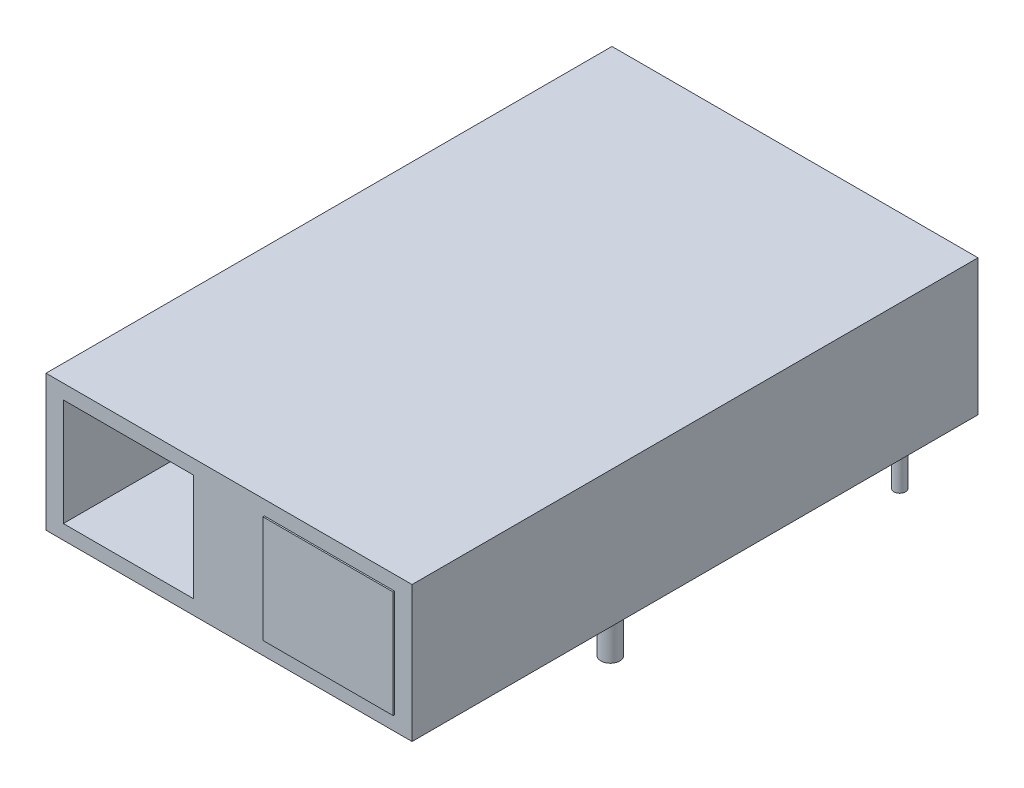
from build123d import *

# Parameters (mm, degrees)
EXTRUDE_1_DEPTH      = 4.7
EXTRUDE_1_DEPTH_BACK = 4.7
SKETCH_1_W           = 25.3
SKETCH_1_H           = 39.12
SKETCH_2_W           = 9
SKETCH_2_H           = 7.4
CUT_EXTRUDE_2_DEPTH  = 10
SKETCH_3_W           = 9
SKETCH_3_H           = 7.4
EXTRUDE_4_DEPTH      = 0.1
SKETCH_4_R           = 0.65
SKETCH_4_R_2         = 0.4
EXTRUDE_3_DEPTH      = 4.2


with BuildPart() as part:
    # 草图1 → 凸台-拉伸1 (new, two sides: drawn at the far end of the back side and taken through both)
    with BuildSketch(Plane(origin=(0, 0, 0), x_dir=(1, 0, 0), z_dir=(0, 1, 0)).offset(-EXTRUDE_1_DEPTH_BACK)):
        Rectangle(SKETCH_1_W, SKETCH_1_H)
    extrude(amount=EXTRUDE_1_DEPTH + EXTRUDE_1_DEPTH_BACK)

    # 草图2 → 切除-拉伸2 (cut)
    with BuildSketch(Plane.XY.offset(19.56)):
        with Locations((-6.95, 0)):
            Rectangle(SKETCH_2_W, SKETCH_2_H)
    extrude(amount=-CUT_EXTRUDE_2_DEPTH, mode=Mode.SUBTRACT)

    # 草图3 → 凸台-拉伸4 (add)
    with BuildSketch(Plane.XY.offset(19.56)):
        with Locations((6.95, 0)):
            Rectangle(SKETCH_3_W, SKETCH_3_H)
    extrude(amount=EXTRUDE_4_DEPTH)

    # 草图4 → 凸台-拉伸3 (add)
    with BuildSketch(Plane.XZ.offset(4.7)):
        with Locations((-10.16, 3.36)):
            Circle(SKETCH_4_R)
        with Locations((10.16, 3.36)):
            Circle(SKETCH_4_R)
        with Locations((-10.16, -16.64)):
            Circle(SKETCH_4_R_2)
        with Locations((-7.62, -16.64)):
            Circle(SKETCH_4_R_2)
        with Locations((-5.08, -16.64)):
            Circle(SKETCH_4_R_2)
        with Locations((-2.54, -16.64)):
            Circle(SKETCH_4_R_2)
        with Locations((0, -16.64)):
            Circle(SKETCH_4_R_2)
        with Locations((2.54, -16.64)):
            Circle(SKETCH_4_R_2)
        with Locations((5.08, -16.64)):
            Circle(SKETCH_4_R_2)
        with Locations((7.62, -16.64)):
            Circle(SKETCH_4_R_2)
        with Locations((10.16, -16.64)):
            Circle(SKETCH_4_R_2)
    extrude(amount=EXTRUDE_3_DEPTH)


solid = part.part
